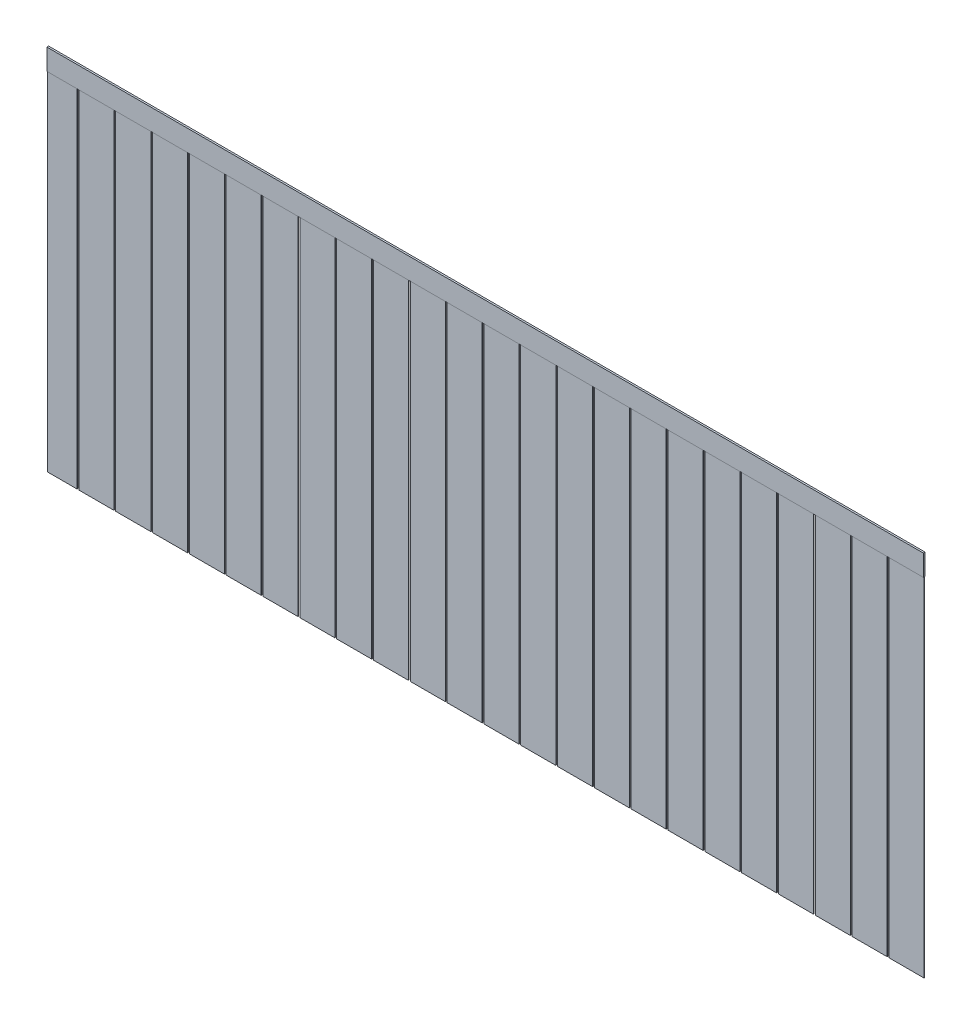
from build123d import *

# Parameters (mm, degrees)
CROQUIS1_W              = 5000
CROQUIS1_H              = 2100
SALIENTE_EXTRUIR1_DEPTH = 10
CROQUIS2_W              = 5000
CROQUIS2_H              = 1980
CORTAR_EXTRUIR1_DEPTH   = 3
CROQUIS3_W              = 5000
CROQUIS3_H              = 1980
CORTAR_EXTRUIR2_DEPTH   = 3
CROQUIS4_W              = 10
CROQUIS4_H              = 1980
CORTAR_EXTRUIR3_DEPTH   = 8
MATRIZL1_COUNT          = 23
MATRIZL1_PITCH          = 210


with BuildPart() as part:
    # Croquis1 → Saliente-Extruir1 (new body)
    with BuildSketch(Plane.XY):
        with Locations((2500, -1050)):
            Rectangle(CROQUIS1_W, CROQUIS1_H)
    extrude(amount=SALIENTE_EXTRUIR1_DEPTH)

    # Croquis2 → Cortar-Extruir1 (cut)
    with BuildSketch(Plane.XY.offset(10)):
        with Locations((2500, -1110)):
            Rectangle(CROQUIS2_W, CROQUIS2_H)
    extrude(amount=-CORTAR_EXTRUIR1_DEPTH, mode=Mode.SUBTRACT)

    # Croquis3 → Cortar-Extruir2 (cut)
    with BuildSketch(Plane(origin=(0, 0, 0), x_dir=(-1, 0, 0), z_dir=(0, 0, -1))):
        with Locations((-2500, -1110)):
            Rectangle(CROQUIS3_W, CROQUIS3_H)
    extrude(amount=-CORTAR_EXTRUIR2_DEPTH, mode=Mode.SUBTRACT)

    # Croquis4 → Cortar-Extruir3 (cut)
    with BuildSketch(Plane(origin=(0, 0, 3), x_dir=(-1, 0, 0), z_dir=(0, 0, -1))):
        with Locations((-4795, -1110)):
            Rectangle(CROQUIS4_W, CROQUIS4_H)
    cortar_extruir3 = extrude(amount=-CORTAR_EXTRUIR3_DEPTH, mode=Mode.SUBTRACT)

    # MatrizL1: Cortar-Extruir3 ×23
    with Locations(*[(-i * MATRIZL1_PITCH, 0, 0) for i in range(1, MATRIZL1_COUNT)]):
        add(cortar_extruir3, mode=Mode.SUBTRACT)


solid = part.part
